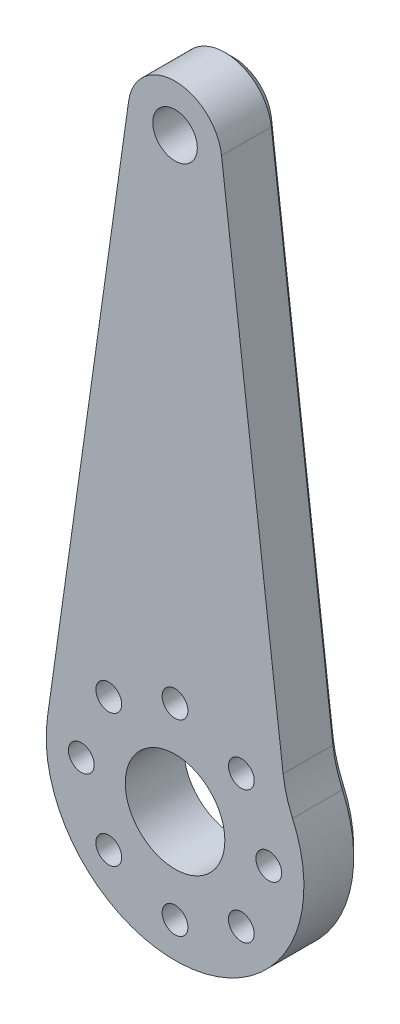
from build123d import *
from build123d.topology import SkipClean

# Parameters (mm, degrees)
SKETCH1_R             = 1.9
SKETCH1_R_2           = 4.25
SKETCH1_R_3           = 1.1
BOSS_EXTRUDE1_DEPTH   = 5
SKETCH4_R             = 1.75
CUT_EXTRUDE3_DEPTH    = 2.25
CORTAR_EXTRUIR1_DEPTH = 10
REDONDEO1_R           = 10
CHAFL_N1_SIZE         = 0.75


with BuildPart() as part:
    # Sketch1 → Boss-Extrude1 (new body)
    with BuildSketch(Plane.XY):
        with BuildLine():
            Line((-19.01038383, 30.596096398), (-25.941444355, -18.423903602))
            ThreePointArc((-25.941444355, -18.423903602), (-15.049777816, -30.963903602), (-4.158111277, -18.423903602))
            Line((-4.158111277, -18.423903602), (-11.089171801, 30.596096398))
            ThreePointArc((-11.089171801, 30.596096398), (-15.049777816, 34.036096398), (-19.01038383, 30.596096398))
        make_face()
        with Locations((-15.049777816, 30.036096398)):
            Circle(SKETCH1_R, mode=Mode.SUBTRACT)
        with Locations((-15.049777816, -19.963903602)):
            Circle(SKETCH1_R_2, mode=Mode.SUBTRACT)
        with Locations((-7.049777816, -19.963903602)):
            Circle(SKETCH1_R_3, mode=Mode.SUBTRACT)
        with Locations((-9.392923566, -25.620757851)):
            Circle(SKETCH1_R_3, mode=Mode.SUBTRACT)
        with Locations((-15.049777816, -27.963903602)):
            Circle(SKETCH1_R_3, mode=Mode.SUBTRACT)
        with Locations((-20.706632065, -25.620757851)):
            Circle(SKETCH1_R_3, mode=Mode.SUBTRACT)
        with Locations((-23.049777816, -19.963903602)):
            Circle(SKETCH1_R_3, mode=Mode.SUBTRACT)
        with Locations((-20.706632065, -14.307049352)):
            Circle(SKETCH1_R_3, mode=Mode.SUBTRACT)
        with Locations((-15.049777816, -11.963903602)):
            Circle(SKETCH1_R_3, mode=Mode.SUBTRACT)
        with Locations((-9.392923566, -14.307049352)):
            Circle(SKETCH1_R_3, mode=Mode.SUBTRACT)
    extrude(amount=BOSS_EXTRUDE1_DEPTH)

    # Sketch4 → Cut-Extrude3 (cut)
    with BuildSketch(Plane(origin=(0, 0, 0), x_dir=(-1, 0, 0), z_dir=(0, 0, -1))):
        with Locations((23.049777816, -19.963903602)):
            Circle(SKETCH4_R)
        with Locations((20.706632065, -25.620757851)):
            Circle(SKETCH4_R)
        with Locations((15.049777816, -27.963903602)):
            Circle(SKETCH4_R)
        with Locations((9.392923566, -25.620757851)):
            Circle(SKETCH4_R)
        with Locations((7.049777816, -19.963903602)):
            Circle(SKETCH4_R)
        with Locations((9.392923566, -14.307049352)):
            Circle(SKETCH4_R)
        with Locations((15.049777816, -11.963903602)):
            Circle(SKETCH4_R)
        with Locations((20.706632065, -14.307049352)):
            Circle(SKETCH4_R)
    extrude(amount=-CUT_EXTRUDE3_DEPTH, mode=Mode.SUBTRACT)

    # Croquis1 → Cortar-Extruir1 (cut)
    with SkipClean():  # the faces are left unmerged after this step: merging them gives an invalid solid
        with BuildSketch(Plane(origin=(0, 0, 0), x_dir=(-1, 0, 0), z_dir=(0, 0, -1))):
            with BuildLine():
                Line((11.079187514, 30.520258202), (5.612387004, -14.312739592))
                ThreePointArc((5.612387004, -14.312739592), (4.679480782, -16.295533469), (4.158111277, -18.423903602))
                Line((4.158111277, -18.423903602), (11.089171801, 30.596096398))
                ThreePointArc((11.089171801, 30.596096398), (11.08399837, 30.558201167), (11.079187514, 30.520258202))
            make_face()
        extrude(amount=-CORTAR_EXTRUIR1_DEPTH, mode=Mode.SUBTRACT)

    # Redondeo1
    redondeo1_edges = [part.edges().sort_by_distance(p)[0] for p in [
        (-5.612387004, -14.312739592, 2.5),
    ]]
    fillet(redondeo1_edges, radius=REDONDEO1_R)

    # Chaflán1
    chafl_n1_edges = [part.edges().sort_by_distance(p)[0] for p in [
        (-8.452968104, 8.982744848, 0),
        (-5.532238153, -14.032345791, 0),
        (-15.049777816, -30.963903602, 0),
        (-22.475914092, 6.086096398, 0),
        (-15.049777816, 34.036096398, 0),
    ]]
    chamfer(chafl_n1_edges, length=CHAFL_N1_SIZE)


solid = part.part
